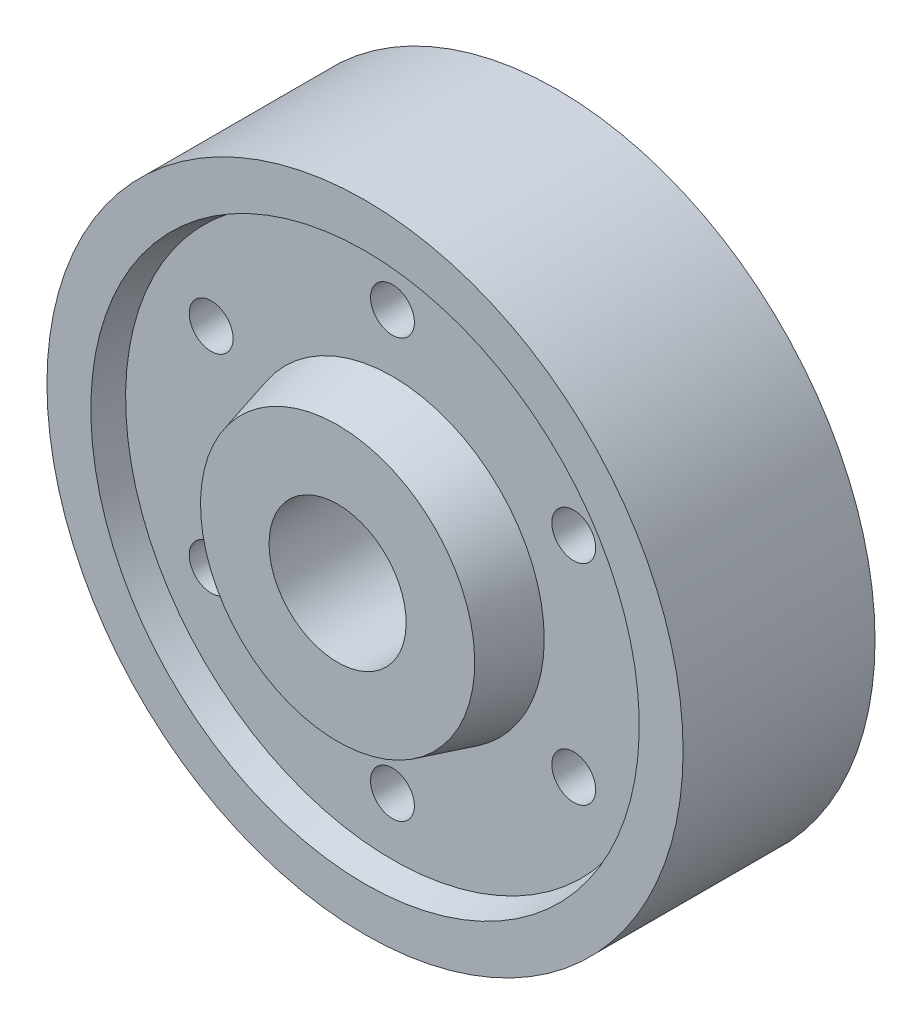
from build123d import *

# Parameters (mm, degrees)
SKETCH3_R          = 4
CUT_EXTRUDE2_DEPTH = 50


with BuildPart() as part:
    # Sketch1 → Revolve2 (revolve)
    with BuildSketch(Plane(origin=(0, 0, 0), x_dir=(0, 0, -1), z_dir=(1, 0, 0))):
        Polygon((-45, 12.5), (-45, 25), (-35, 27.679491924), (-35, 48.660254038), (-40, 50), (-40, 58), (-5, 58), (-5, 50), (-10, 48.660254038), (-10, 27.679491924), (0, 25), (0, 12.5), align=None)
    revolve(axis=Axis((0, 0, 0), (0, 0, 1)))

    # Sketch3 → Cut-Extrude2 (cut)
    with BuildSketch(Plane.XY.offset(35)):
        with Locations((-33.056079661, -19.084936491)):
            Circle(SKETCH3_R)
        with Locations((0, 38.169872981)):
            Circle(SKETCH3_R)
        with Locations((-33.056079661, 19.084936491)):
            Circle(SKETCH3_R)
        with Locations((0, -38.169872981)):
            Circle(SKETCH3_R)
        with Locations((33.056079661, -19.084936491)):
            Circle(SKETCH3_R)
        with Locations((33.056079661, 19.084936491)):
            Circle(SKETCH3_R)
    extrude(amount=-CUT_EXTRUDE2_DEPTH, mode=Mode.SUBTRACT)


solid = part.part
